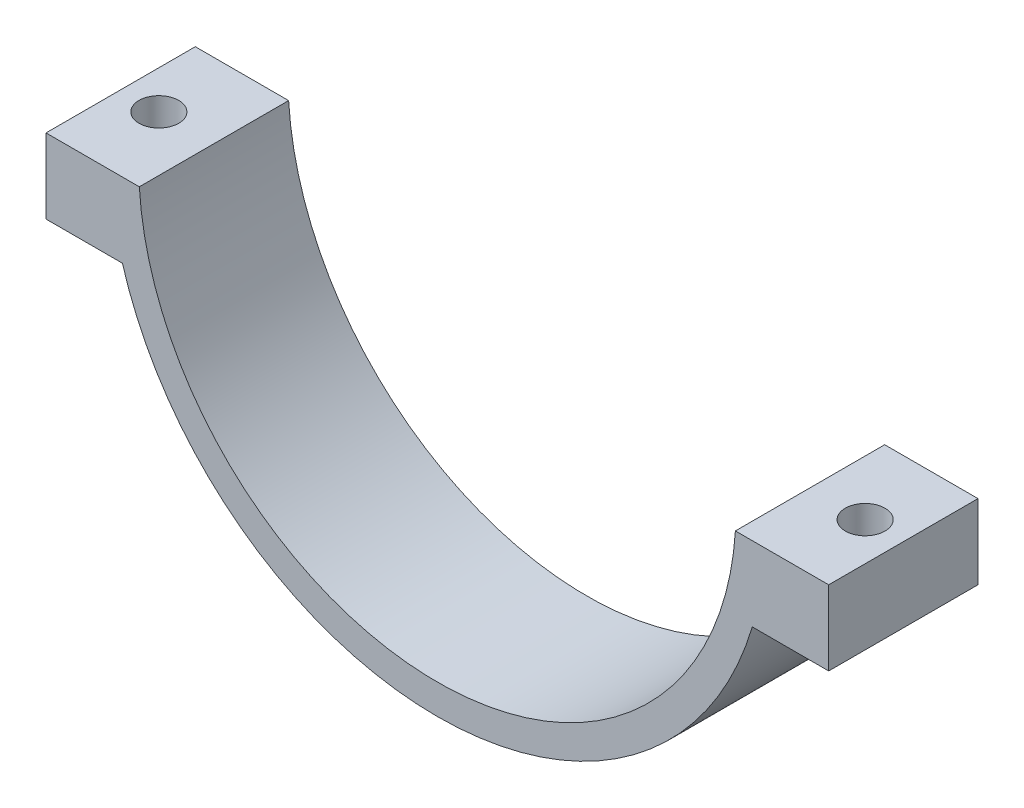
from build123d import *

# Parameters (mm, degrees)
BOSS_EXTRUDE1_DEPTH               = 12.7
F_1_4_CLEARANCE_HOLE1_D           = 6.7564
F_1_4_CLEARANCE_HOLE1_CSINK_D     = 8.0264
F_1_4_CLEARANCE_HOLE1_CSINK_ANGLE = 90


with BuildPart() as part:
    # Sketch1 → Boss-Extrude1 (new, symmetric)
    with BuildSketch(Plane.XY):
        with BuildLine():
            Line((-50.700684167, 47.625), (-66.575684167, 47.625))
            Line((-66.575684167, 47.625), (-66.575684167, 34.925))
            Line((-66.575684167, 34.925), (-53.577595831, 34.925))
            ThreePointArc((-53.577595831, 34.925), (0, -5.08), (53.577595831, 34.925))
            Line((53.577595831, 34.925), (66.575684167, 34.925))
            Line((66.575684167, 34.925), (66.575684167, 47.625))
            Line((66.575684167, 47.625), (50.700684167, 47.625))
            ThreePointArc((50.700684167, 47.625), (0, 0), (-50.700684167, 47.625))
        make_face()
    extrude(amount=BOSS_EXTRUDE1_DEPTH, both=True)

    # 1/4 Clearance Hole1 (through all)
    with Locations(Plane(origin=(0, 34.925, 0), x_dir=(-1, 0, 0), z_dir=(0, -1, 0))):
        with Locations((60.076639999, 0), (-60.076639999, 0)):
            CounterSinkHole(F_1_4_CLEARANCE_HOLE1_D / 2, F_1_4_CLEARANCE_HOLE1_CSINK_D / 2, counter_sink_angle=F_1_4_CLEARANCE_HOLE1_CSINK_ANGLE)


solid = part.part
